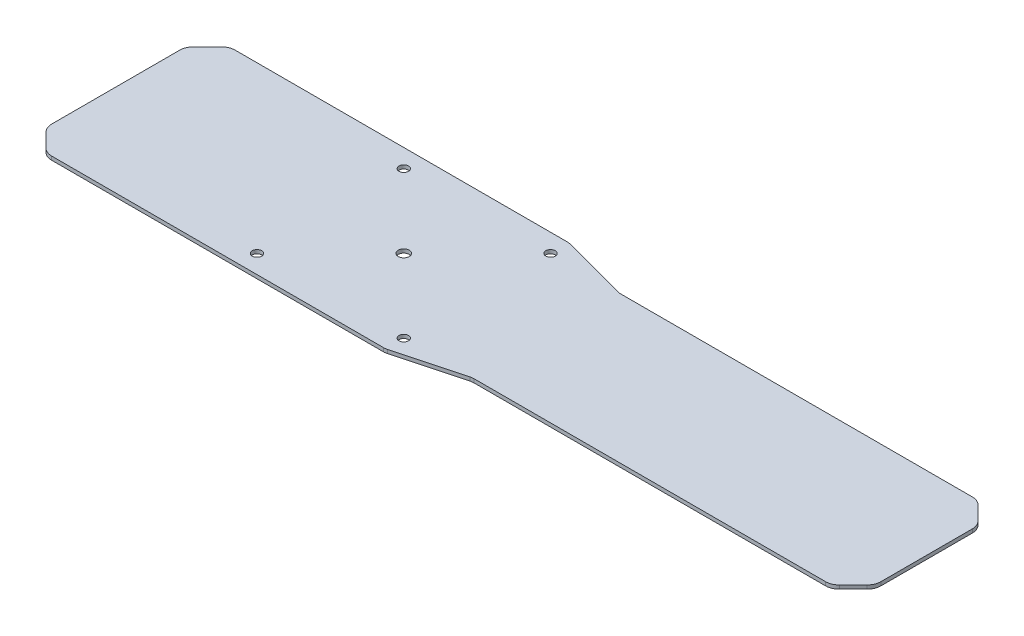
from build123d import *

# Parameters (mm, degrees)
BOSS_EXTRUDE2_DEPTH = 2
CHAMFER2_SIZE       = 12
FILLET1_R           = 7.5
SKETCH2_R           = 2.575
SKETCH2_R_2         = 3
CUT_EXTRUDE1_DEPTH  = 290.359637821


with BuildPart() as part:
    # Sketch1 → Boss-Extrude2 (new body)
    with BuildSketch(Plane(origin=(0, 0, 0), x_dir=(1, 0, 0), z_dir=(0, 1, 0))):
        Polygon((40, -50), (77.320508076, -40), (285, -40), (285, 40), (77.320508076, 40), (40, 50), (-40, 50), (-157, 50), (-157, -50), (-40, -50), align=None)
    extrude(amount=BOSS_EXTRUDE2_DEPTH)

    # Chamfer2
    chamfer2_edges = [part.edges().sort_by_distance(p)[0] for p in [
        (-157, 1, 50),
        (-157, 1, -50),
        (285, 1, -40),
        (285, 1, 40),
    ]]
    chamfer(chamfer2_edges, length=CHAMFER2_SIZE)

    # Fillet1
    fillet1_edges = [part.edges().sort_by_distance(p)[0] for p in [
        (40, 1, -50),
        (77.320508076, 1, -40),
        (77.320508076, 1, 40),
        (40, 1, 50),
        (-145, 1, 50),
        (-157, 1, -38),
        (-157, 1, 38),
        (-145, 1, -50),
        (273, 1, -40),
        (285, 1, 28),
        (285, 1, -28),
        (273, 1, 40),
    ]]
    fillet(fillet1_edges, radius=FILLET1_R)

    # Sketch2 → Cut-Extrude1 (cut, through all)
    with BuildSketch(Plane(origin=(0, 2, 0), x_dir=(1, 0, 0), z_dir=(0, 1, 0))):
        with Locations(Location((-40, 40, 0), (0, 0, 270))):
            Circle(SKETCH2_R)
        with Locations(Location((40, 40, 0), (0, 0, 90))):
            Circle(SKETCH2_R)
        with Locations(Location((40, -40, 0), (0, 0, 270))):
            Circle(SKETCH2_R)
        with Locations(Location((-40, -40, 0), (0, 0, 90))):
            Circle(SKETCH2_R)
        with Locations(Location((0, 0, 0), (0, 0, 270))):
            Circle(SKETCH2_R_2)
    extrude(amount=-CUT_EXTRUDE1_DEPTH, mode=Mode.SUBTRACT)


solid = part.part
